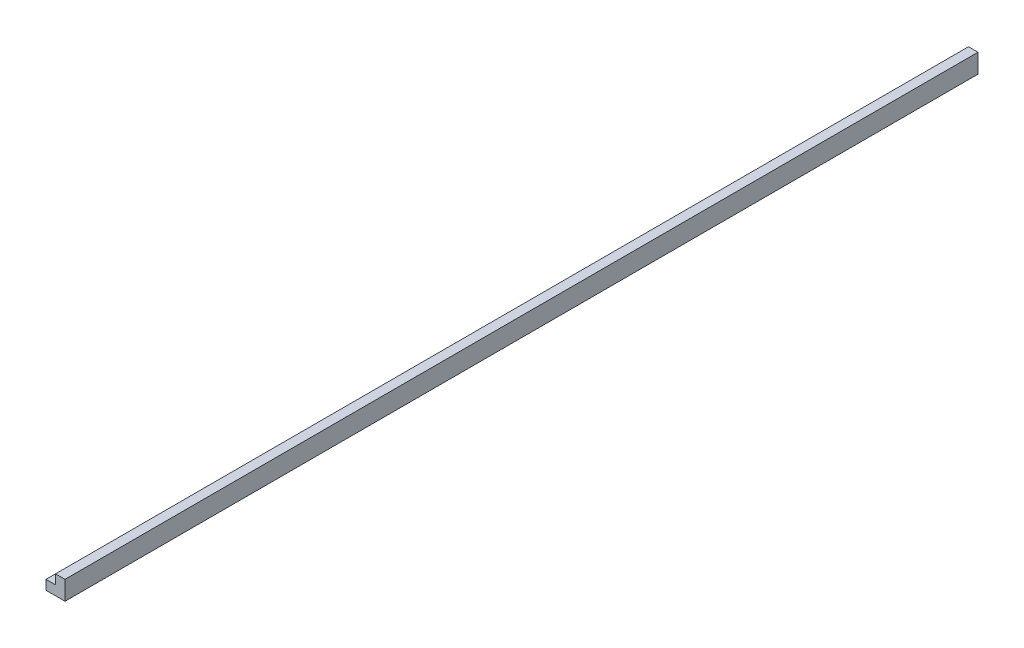
from build123d import *

# Parameters (mm, degrees)
BOSS_EXTRUDE1_DEPTH      = 304.8
BOSS_EXTRUDE1_DEPTH_BACK = 304.8


with BuildPart() as part:
    # Sketch3 → Boss-Extrude1 (new, two sides: drawn at the far end of the back side and taken through both)
    with BuildSketch(Plane.XY.offset(-BOSS_EXTRUDE1_DEPTH_BACK)):
        Polygon((-12.7, 0), (0, 0), (0, 12.7), (-6.35, 12.7), (-6.35, 6.35), (-12.7, 6.35), align=None)
    extrude(amount=BOSS_EXTRUDE1_DEPTH + BOSS_EXTRUDE1_DEPTH_BACK)


solid = part.part
